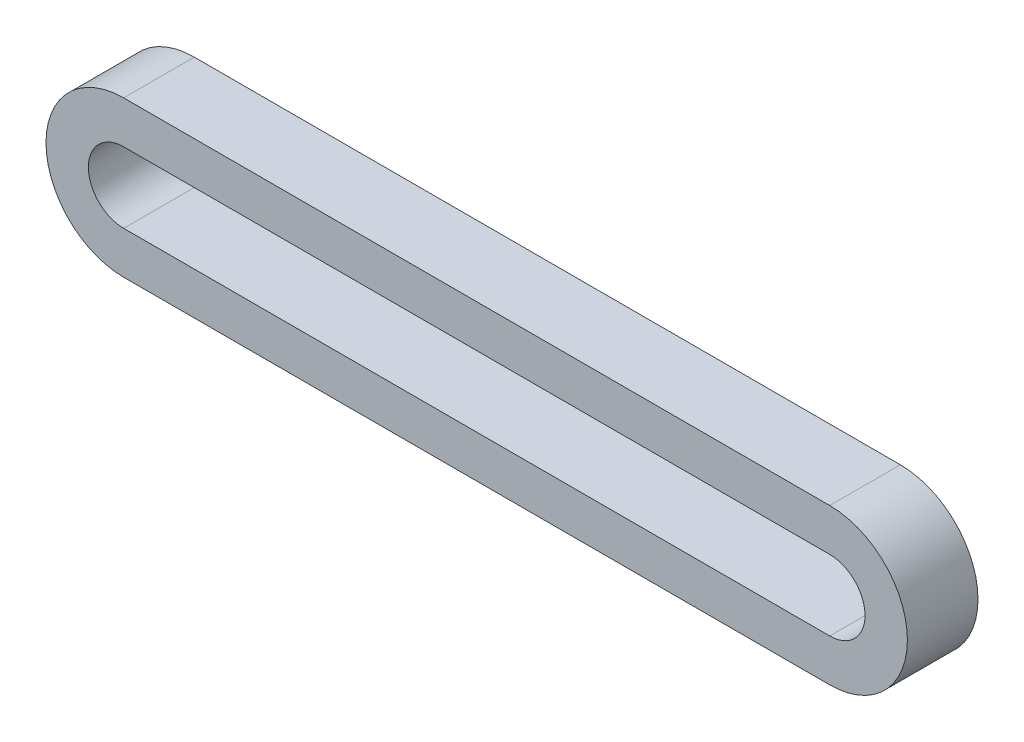
from build123d import *

# Parameters (mm, degrees)
BOSS_EXTRUDE1_DEPTH = 5


with BuildPart() as part:
    # Sketch2 → Boss-Extrude1 (new body)
    with BuildSketch(Plane.XY):
        with BuildLine():
            Line((0, 5.5), (50, 5.5))
            ThreePointArc((50, 5.5), (55.5, 0), (50, -5.5))
            Line((50, -5.5), (0, -5.5))
            ThreePointArc((0, -5.5), (-5.5, 0), (0, 5.5))
        make_face()
        with BuildLine():
            ThreePointArc((50, -2.5), (52.5, 0), (50, 2.5))
            Line((50, 2.5), (0, 2.5))
            ThreePointArc((0, 2.5), (-2.5, 0), (0, -2.5))
            Line((0, -2.5), (50, -2.5))
        make_face(mode=Mode.SUBTRACT)
    extrude(amount=BOSS_EXTRUDE1_DEPTH)


solid = part.part
